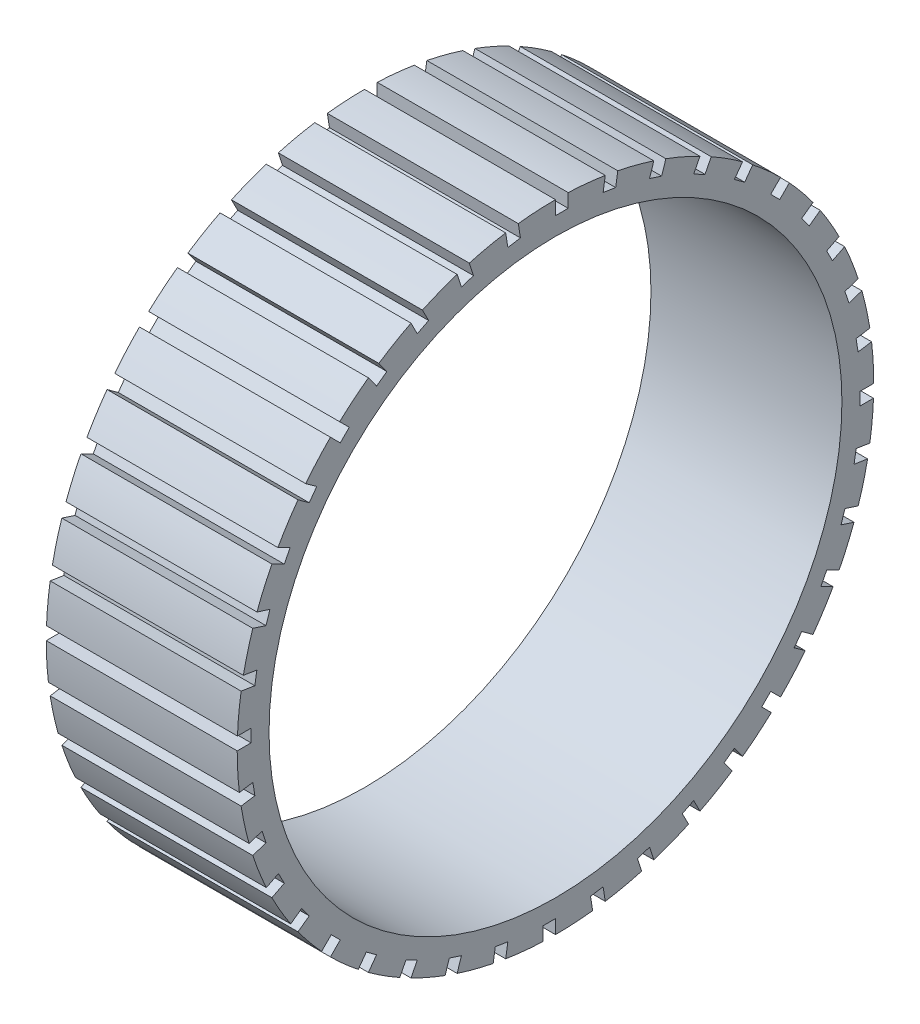
from build123d import *

# Parameters (mm, degrees)
SKETCH1_R           = 63.5
BOSS_EXTRUDE1_DEPTH = 38.1
SKETCH2_R           = 57.15
CUT_EXTRUDE4_DEPTH  = 40.64
SKETCH4_W           = 2.772986199
SKETCH4_H           = 2.54
CUT_EXTRUDE7_DEPTH  = 40.64
CIRPATTERN1_COUNT   = 40


with BuildPart() as part:
    # Sketch1 → Boss-Extrude1 (new body)
    with BuildSketch(Plane(origin=(0, 0, 0), x_dir=(0, 0, -1), z_dir=(1, 0, 0))):
        with Locations(Location((0, 0, 0), (0, 0, 180))):
            Circle(SKETCH1_R)
    extrude(amount=BOSS_EXTRUDE1_DEPTH)

    # Sketch2 → Cut-Extrude4 (cut)
    with BuildSketch(Plane(origin=(0, 0, 0), x_dir=(0, 0, -1), z_dir=(1, 0, 0))):
        Circle(SKETCH2_R)
    extrude(amount=CUT_EXTRUDE4_DEPTH, mode=Mode.SUBTRACT)

    # Sketch4 → Cut-Extrude7 (cut)
    with BuildSketch(Plane.ZY):
        with Locations((-62.113506901, -1.27)):
            Rectangle(SKETCH4_W, SKETCH4_H)
    cut_extrude7 = extrude(amount=-CUT_EXTRUDE7_DEPTH, mode=Mode.SUBTRACT)

    # CirPattern1: Cut-Extrude7 ×40 about axis
    cirpattern1_axis = Axis((0, 0, 0), (1, 0, 0))
    for i in range(1, CIRPATTERN1_COUNT):
        add(cut_extrude7.rotate(cirpattern1_axis, i * 360 / CIRPATTERN1_COUNT), mode=Mode.SUBTRACT)


solid = part.part
